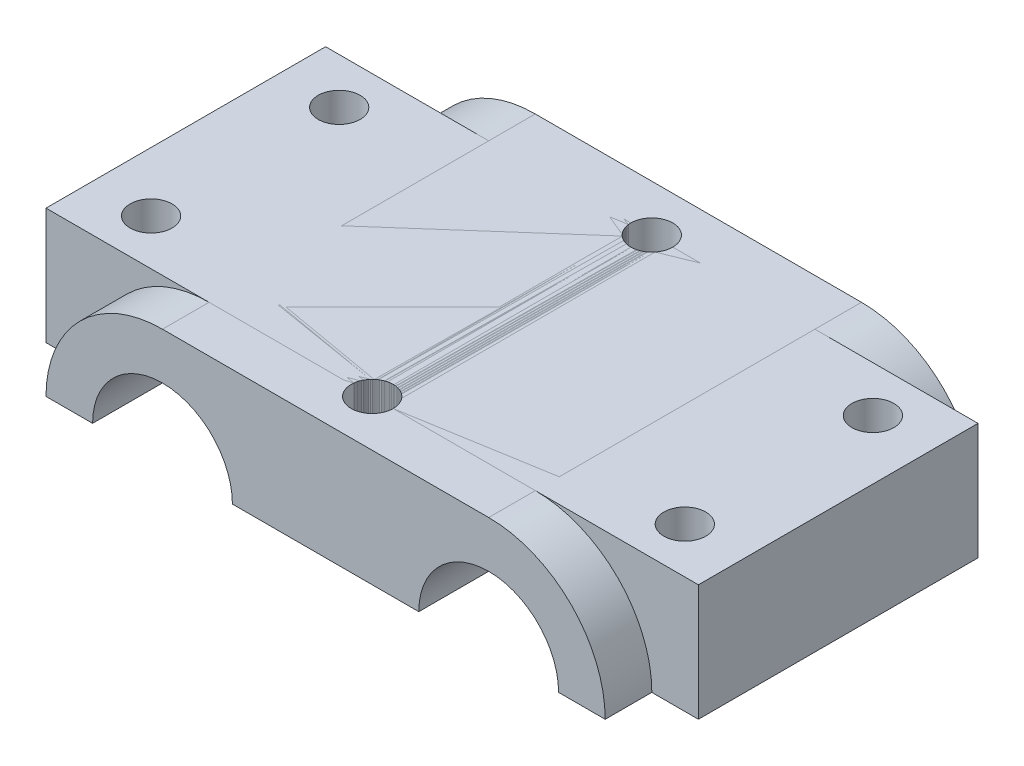
from build123d import *

# Parameters (mm, degrees)
BOSS_EXTRUDE1_DEPTH      = 30
BOSS_EXTRUDE2_DEPTH      = 5
BOSS_EXTRUDE2_DEPTH_BACK = 35
SKETCH3_R                = 2.25
CUT_EXTRUDE1_DEPTH       = 52.051444642


with BuildPart() as part:
    # Sketch1 → Boss-Extrude1 (new body)
    with BuildSketch(Plane.XY):
        with BuildLine():
            Line((-10, -6.25), (10, -6.25))
            ThreePointArc((10, -6.25), (17.5, 1.25), (25, -6.25))
            Line((25, -6.25), (35, -6.25))
            Line((35, -6.25), (35, 6.25))
            Line((35, 6.25), (-35, 6.25))
            Line((-35, 6.25), (-35, -6.25))
            Line((-35, -6.25), (-25, -6.25))
            ThreePointArc((-25, -6.25), (-17.5, 1.25), (-10, -6.25))
        make_face()
    extrude(amount=BOSS_EXTRUDE1_DEPTH)


with BuildPart() as body_2:
    # Sketch2 → Boss-Extrude2 (new, two sides: drawn at the far end of the back side and taken through both)
    with BuildSketch(Plane.XY.offset(30).offset(-BOSS_EXTRUDE2_DEPTH_BACK)):
        with BuildLine():
            Line((-25, -6.25), (-30, -6.25))
            ThreePointArc((-30, -6.25), (-26.338834765, 2.588834765), (-17.5, 6.25))
            Line((-17.5, 6.25), (17.5, 6.25))
            ThreePointArc((17.5, 6.25), (26.338834765, 2.588834765), (30, -6.25))
            Line((30, -6.25), (25, -6.25))
            ThreePointArc((25, -6.25), (17.5, 1.25), (10, -6.25))
            Line((10, -6.25), (-10, -6.25))
            ThreePointArc((-10, -6.25), (-17.5, 1.25), (-25, -6.25))
        make_face()
    extrude(amount=BOSS_EXTRUDE2_DEPTH + BOSS_EXTRUDE2_DEPTH_BACK)


with BuildPart() as cut_extrude1_tool:
    # Sketch3 → Cut-Extrude1 (new, through all)
    with BuildSketch(Plane(origin=(0, 6.25, 0), x_dir=(1, 0, 0), z_dir=(0, 1, 0))):
        with Locations(Location((0, 0, 0), (0, 0, 180))):
            Circle(SKETCH3_R)
        with Locations(Location((-28.633056951, -4.908908195, 0), (0, 0, 180))):
            Circle(SKETCH3_R)
        with Locations(Location((28.633056951, -4.908908195, 0), (0, 0, 180))):
            Circle(SKETCH3_R)
        with Locations(Location((28.633056951, -25.091091805, 0), (0, 0, 180))):
            Circle(SKETCH3_R)
        with Locations(Location((0, -30, 0), (0, 0, 180))):
            Circle(SKETCH3_R)
        with Locations(Location((-28.633056951, -25.091091805, 0), (0, 0, 180))):
            Circle(SKETCH3_R)
    extrude(amount=-CUT_EXTRUDE1_DEPTH)


with BuildPart() as part_1:
    add(part.part)

    # Cut-Extrude1: cut by cut_extrude1_tool
    add(cut_extrude1_tool.part, mode=Mode.SUBTRACT)


with BuildPart() as body_2_1:
    add(body_2.part)

    # Cut-Extrude1: cut by cut_extrude1_tool
    add(cut_extrude1_tool.part, mode=Mode.SUBTRACT)


solid = Compound([part_1.part, body_2_1.part])
